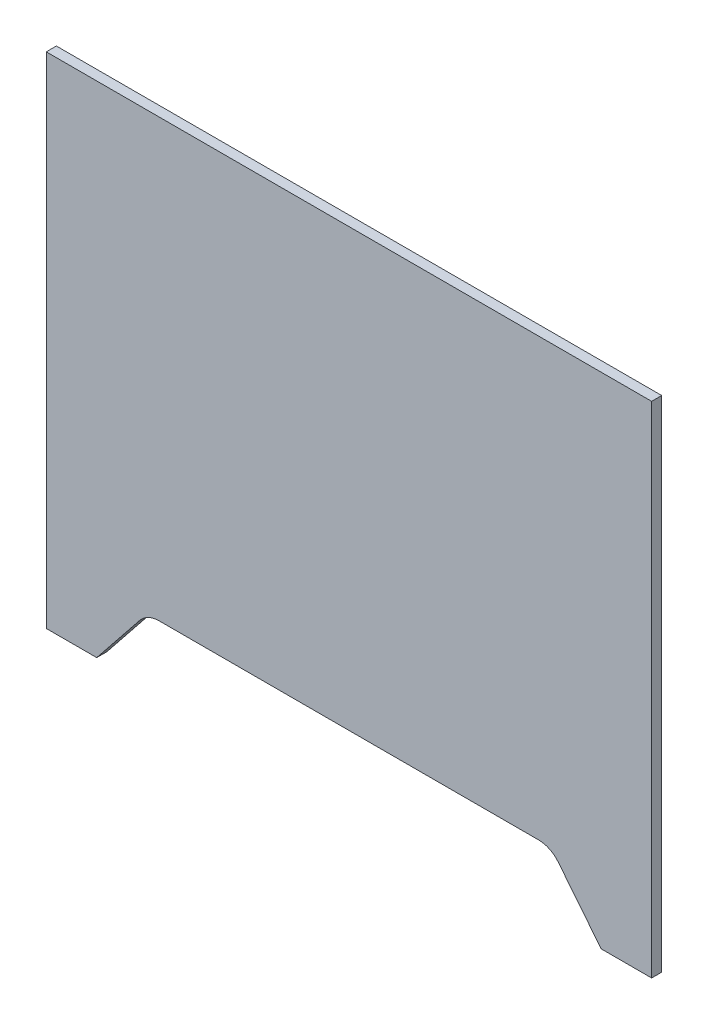
from build123d import *

# Parameters (mm, degrees)
BOSS_EXTRUDE1_DEPTH = 4


with BuildPart() as part:
    # Sketch1 → Boss-Extrude1 (new body)
    with BuildSketch(Plane.XY):
        with BuildLine():
            Line((-120, -99), (-120, 99))
            Line((-120, 99), (120, 99))
            Line((120, 99), (120, -99))
            Line((120, -99), (100, -99))
            Line((100, -99), (83.00243962, -77.753049524))
            ThreePointArc((83.00243962, -77.753049524), (79.52563883, -74.986967637), (75.193751525, -74))
            Line((75.193751525, -74), (-75.193751525, -74))
            ThreePointArc((-75.193751525, -74), (-79.52563883, -74.986967637), (-83.00243962, -77.753049524))
            Line((-83.00243962, -77.753049524), (-100, -99))
            Line((-100, -99), (-120, -99))
        make_face()
    extrude(amount=BOSS_EXTRUDE1_DEPTH)


solid = part.part
